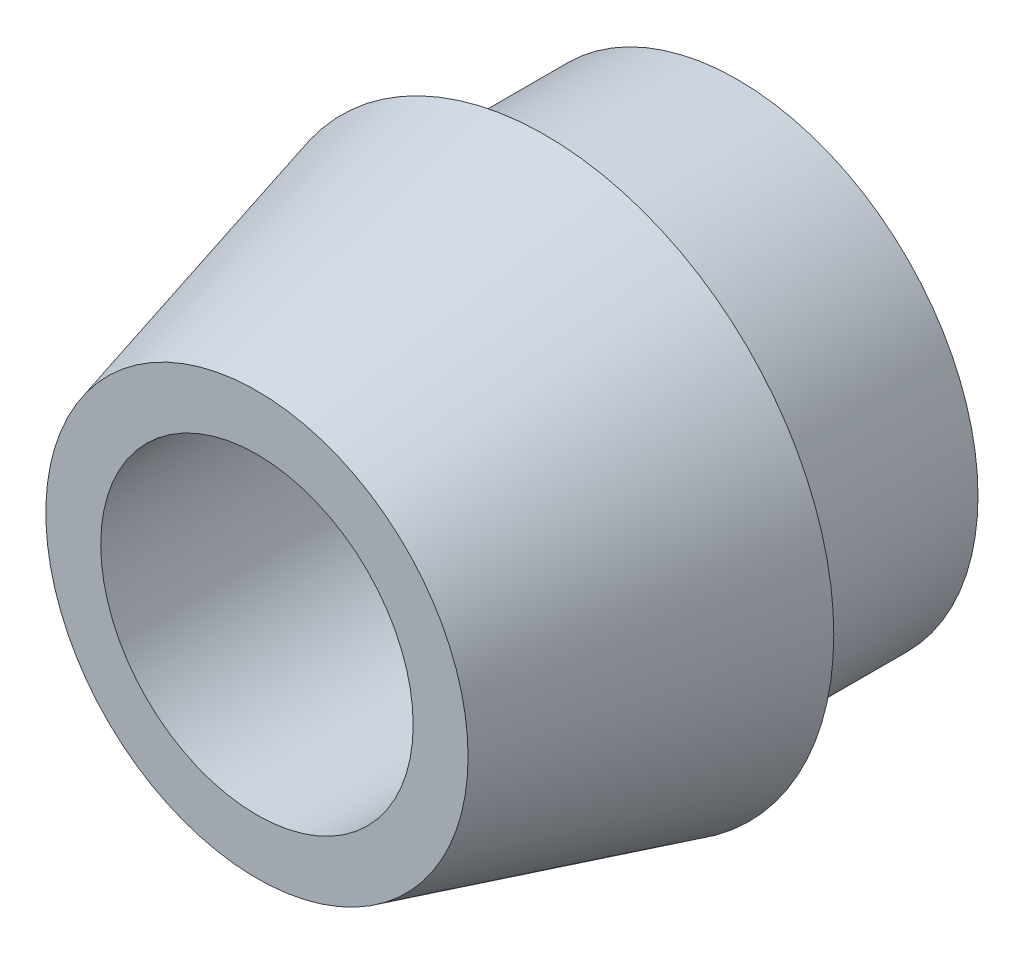
from build123d import *

# Parameters (mm, degrees)
SKETCH3_R           = 50
SKETCH3_R_2         = 35
BOSS_EXTRUDE3_DEPTH = 40
SKETCH6_R           = 60
BOSS_EXTRUDE5_DEPTH = 60
BOSS_EXTRUDE5_TAPER = 15
SKETCH7_R           = 32.5
CUT_EXTRUDE1_DEPTH  = 132.148770486


with BuildPart() as part:
    # Sketch3 → Boss-Extrude3 (new body)
    with BuildSketch(Plane.XY):
        Circle(SKETCH3_R)
        Circle(SKETCH3_R_2, mode=Mode.SUBTRACT)
    extrude(amount=BOSS_EXTRUDE3_DEPTH)

    # Sketch6 → Boss-Extrude5 (add)
    with BuildSketch(Plane.XY.offset(40)):
        Circle(SKETCH6_R)
    extrude(amount=BOSS_EXTRUDE5_DEPTH, taper=BOSS_EXTRUDE5_TAPER)

    # Sketch7 → Cut-Extrude1 (cut, through all)
    with BuildSketch(Plane.XY.offset(100)):
        Circle(SKETCH7_R)
    extrude(amount=-CUT_EXTRUDE1_DEPTH, mode=Mode.SUBTRACT)


solid = part.part
